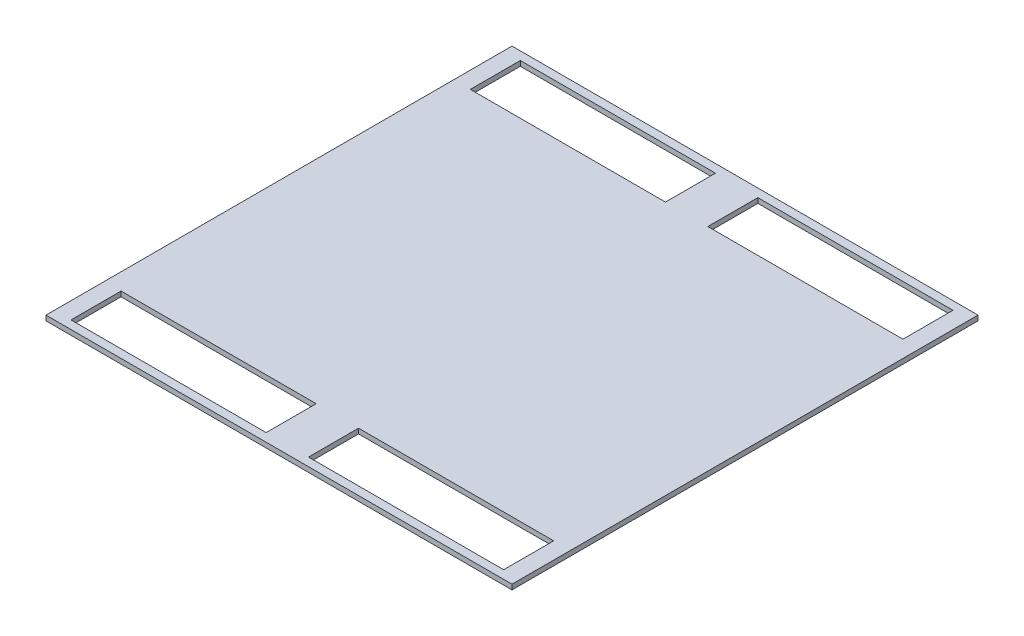
from build123d import *

# Parameters (mm, degrees)
SKETCH1_W           = 279.4
SKETCH1_H           = 279.4
SKETCH1_W_2         = 117
SKETCH1_H_2         = 30
BOSS_EXTRUDE1_DEPTH = 3


with BuildPart() as part:
    # Sketch1 → Boss-Extrude1 (new body)
    with BuildSketch(Plane(origin=(0, 0, 0), x_dir=(1, 0, 0), z_dir=(0, 1, 0))):
        Rectangle(SKETCH1_W, SKETCH1_H)
        with Locations((-71.2, 119.7)):
            Rectangle(SKETCH1_W_2, SKETCH1_H_2, mode=Mode.SUBTRACT)
        with Locations((71.2, 119.7)):
            Rectangle(SKETCH1_W_2, SKETCH1_H_2, mode=Mode.SUBTRACT)
        with Locations((71.2, -119.7)):
            Rectangle(SKETCH1_W_2, SKETCH1_H_2, mode=Mode.SUBTRACT)
        with Locations((-71.2, -119.7)):
            Rectangle(SKETCH1_W_2, SKETCH1_H_2, mode=Mode.SUBTRACT)
    extrude(amount=BOSS_EXTRUDE1_DEPTH)


solid = part.part
